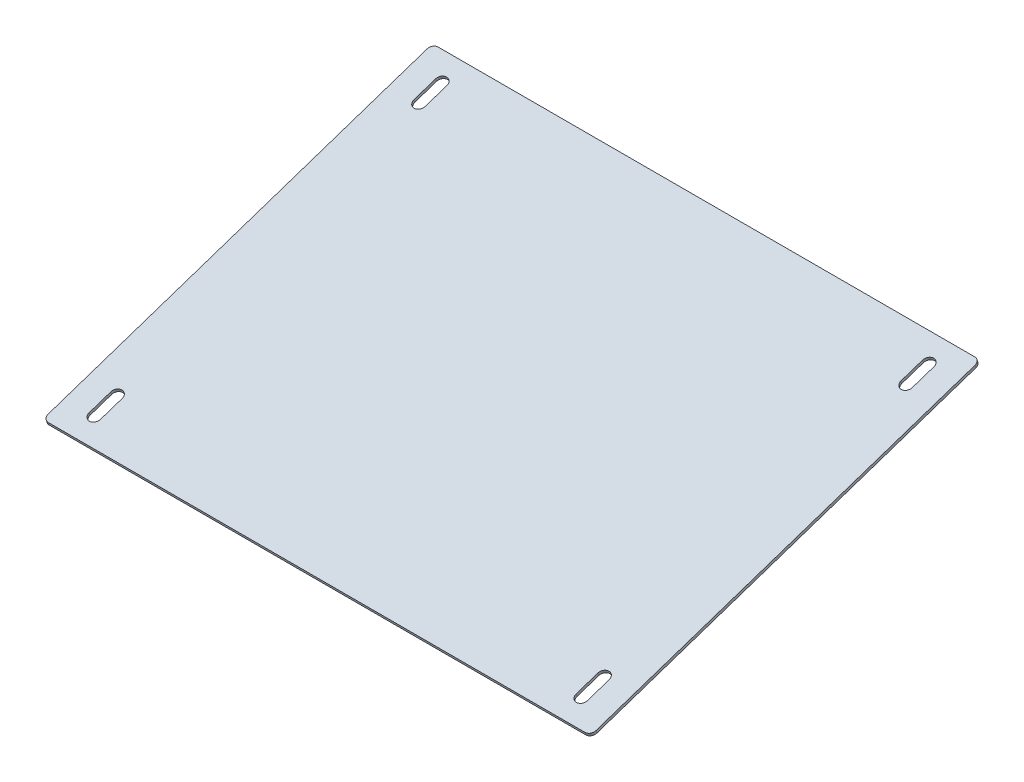
from build123d import *

# Parameters (mm, degrees)
SKETCH3_W           = 457.2
SKETCH3_H           = 609.6
BOSS_EXTRUDE1_DEPTH = 3.175
FILLET1_R           = 6.35


with BuildPart() as part:
    # Sketch3 → Boss-Extrude1 (new body)
    with BuildSketch(Plane(origin=(0, 0, 0), x_dir=(0, 0.3173046564050865, -0.9483236552062013), z_dir=(0, -0.9483236552062012, -0.3173046564050864))):
        Rectangle(SKETCH3_W, SKETCH3_H)
        with BuildLine():
            Line((203.2, -277.283333333), (177.8, -277.283333333))
            ThreePointArc((177.8, -277.283333333), (171.45, -270.933333333), (177.8, -264.583333333))
            Line((177.8, -264.583333333), (203.2, -264.583333333))
            ThreePointArc((203.2, -264.583333333), (209.55, -270.933333333), (203.2, -277.283333333))
        make_face(mode=Mode.SUBTRACT)
        with BuildLine():
            Line((-203.2, -264.583333333), (-177.8, -264.583333333))
            ThreePointArc((-177.8, -264.583333333), (-171.45, -270.933333333), (-177.8, -277.283333333))
            Line((-177.8, -277.283333333), (-203.2, -277.283333333))
            ThreePointArc((-203.2, -277.283333333), (-209.55, -270.933333333), (-203.2, -264.583333333))
        make_face(mode=Mode.SUBTRACT)
        with BuildLine():
            Line((203.2, 277.283333333), (177.8, 277.283333333))
            ThreePointArc((177.8, 277.283333333), (171.45, 270.933333333), (177.8, 264.583333333))
            Line((177.8, 264.583333333), (203.2, 264.583333333))
            ThreePointArc((203.2, 264.583333333), (209.55, 270.933333333), (203.2, 277.283333333))
        make_face(mode=Mode.SUBTRACT)
        with BuildLine():
            Line((-203.2, 264.583333333), (-177.8, 264.583333333))
            ThreePointArc((-177.8, 264.583333333), (-171.45, 270.933333333), (-177.8, 277.283333333))
            Line((-177.8, 277.283333333), (-203.2, 277.283333333))
            ThreePointArc((-203.2, 277.283333333), (-209.55, 270.933333333), (-203.2, 264.583333333))
        make_face(mode=Mode.SUBTRACT)
    extrude(amount=-BOSS_EXTRUDE1_DEPTH)

    # Fillet1
    fillet1_edges = [part.edges().sort_by_distance(p)[0] for p in [
        (-304.8, 74.041308257, -216.283066438),
        (-304.8, -71.030380652, 217.290508722),
        (304.8, -71.030380652, 217.290508722),
        (304.8, 74.041308257, -216.283066438),
    ]]
    fillet(fillet1_edges, radius=FILLET1_R)


solid = part.part
